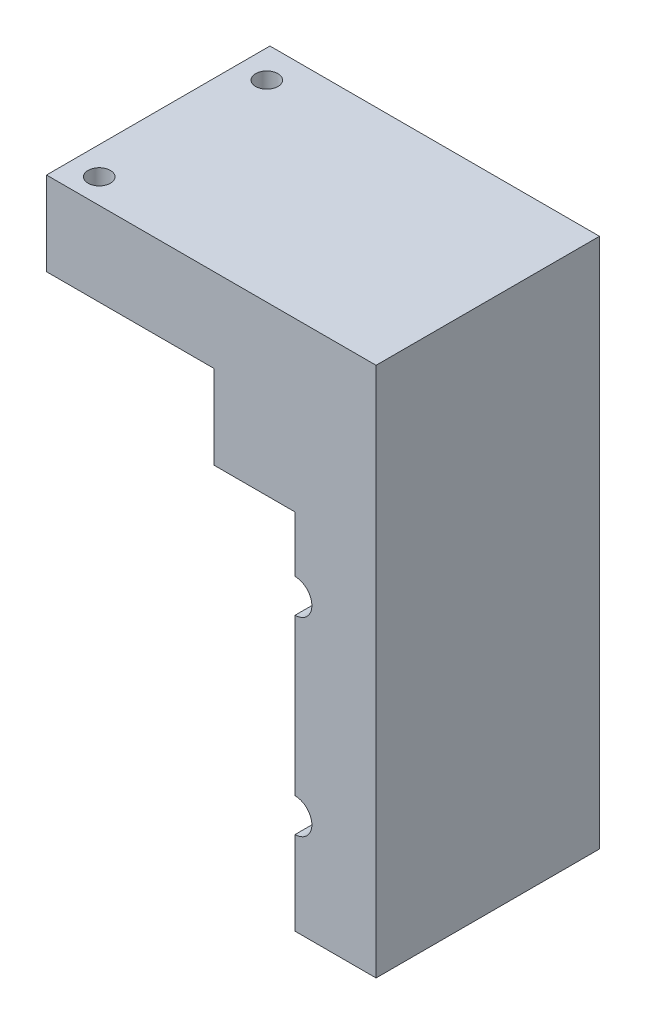
from build123d import *

# Parameters (mm, degrees)
SKETCH_3_W          = 29
SKETCH_3_H          = 95
EXTRUDE_1_DEPTH     = 40
SKETCH_4_R          = 3.005
CUT_EXTRUDE_1_DEPTH = 108.079409785
SKETCH_6_W          = 40
SKETCH_6_H          = 15
EXTRUDE_3_DEPTH     = 30
SKETCH_7_W          = 14.5
SKETCH_7_H          = 65
CUT_EXTRUDE_2_DEPTH = 108.354552768
SKETCH_9_R          = 2
CUT_EXTRUDE_4_DEPTH = 5
SKETCH_10_R         = 2
CUT_EXTRUDE_5_DEPTH = 5
SKETCH_11_R         = 2
CUT_EXTRUDE_6_DEPTH = 5
SKETCH_12_R         = 2
CUT_EXTRUDE_7_DEPTH = 5


with BuildPart() as part:
    # 草图3 → 凸台-拉伸1 (new body)
    with BuildSketch(Plane.XY):
        with Locations((14.5, 47.5)):
            Rectangle(SKETCH_3_W, SKETCH_3_H)
    extrude(amount=EXTRUDE_1_DEPTH)

    # 草图4 → 切除-拉伸1 (cut, through all)
    with BuildSketch(Plane.XY.offset(40)):
        with Locations((14.5, 52)):
            Circle(SKETCH_4_R)
        with Locations((14.5, 18)):
            Circle(SKETCH_4_R)
    extrude(amount=-CUT_EXTRUDE_1_DEPTH, mode=Mode.SUBTRACT)

    # 草图6 → 凸台-拉伸3 (add)
    with BuildSketch(Plane.ZY):
        with Locations((20, 87.5)):
            Rectangle(SKETCH_6_W, SKETCH_6_H)
    extrude(amount=EXTRUDE_3_DEPTH)

    # 草图7 → 切除-拉伸2 (cut, through all)
    with BuildSketch(Plane.XY.offset(40)):
        with Locations((7.25, 32.5)):
            Rectangle(SKETCH_7_W, SKETCH_7_H)
    extrude(amount=-CUT_EXTRUDE_2_DEPTH, mode=Mode.SUBTRACT)

    # 草图9 → 切除-拉伸4 (cut)
    with BuildSketch(Plane.ZY.offset(-14.5)):
        with Locations(Location((5, 60.0025, 0), (0, 0, 270))):
            Circle(SKETCH_9_R)
        with Locations(Location((35, 60.0025, 0), (0, 0, 270))):
            Circle(SKETCH_9_R)
    extrude(amount=-CUT_EXTRUDE_4_DEPTH, mode=Mode.SUBTRACT)

    # 草图10 → 切除-拉伸5 (cut)
    with BuildSketch(Plane.ZY.offset(-14.5)):
        with Locations(Location((5, 7.4975, 0), (0, 0, 270))):
            Circle(SKETCH_10_R)
        with Locations(Location((35, 7.4975, 0), (0, 0, 270))):
            Circle(SKETCH_10_R)
    extrude(amount=-CUT_EXTRUDE_5_DEPTH, mode=Mode.SUBTRACT)

    # 草图11 → 切除-拉伸6 (cut)
    with BuildSketch(Plane.ZY.offset(-14.5)):
        with Locations(Location((5, 35, 0), (0, 0, 270))):
            Circle(SKETCH_11_R)
        with Locations(Location((35, 35, 0), (0, 0, 270))):
            Circle(SKETCH_11_R)
    extrude(amount=-CUT_EXTRUDE_6_DEPTH, mode=Mode.SUBTRACT)

    # 草图12 → 切除-拉伸7 (cut)
    with BuildSketch(Plane(origin=(0, 95, 0), x_dir=(1, 0, 0), z_dir=(0, 1, 0))):
        with Locations(Location((-25, -35.563533882, 0), (0, 0, 270))):
            Circle(SKETCH_12_R)
        with Locations(Location((-25, -5.563533882, 0), (0, 0, 270))):
            Circle(SKETCH_12_R)
    extrude(amount=-CUT_EXTRUDE_7_DEPTH, mode=Mode.SUBTRACT)


solid = part.part
